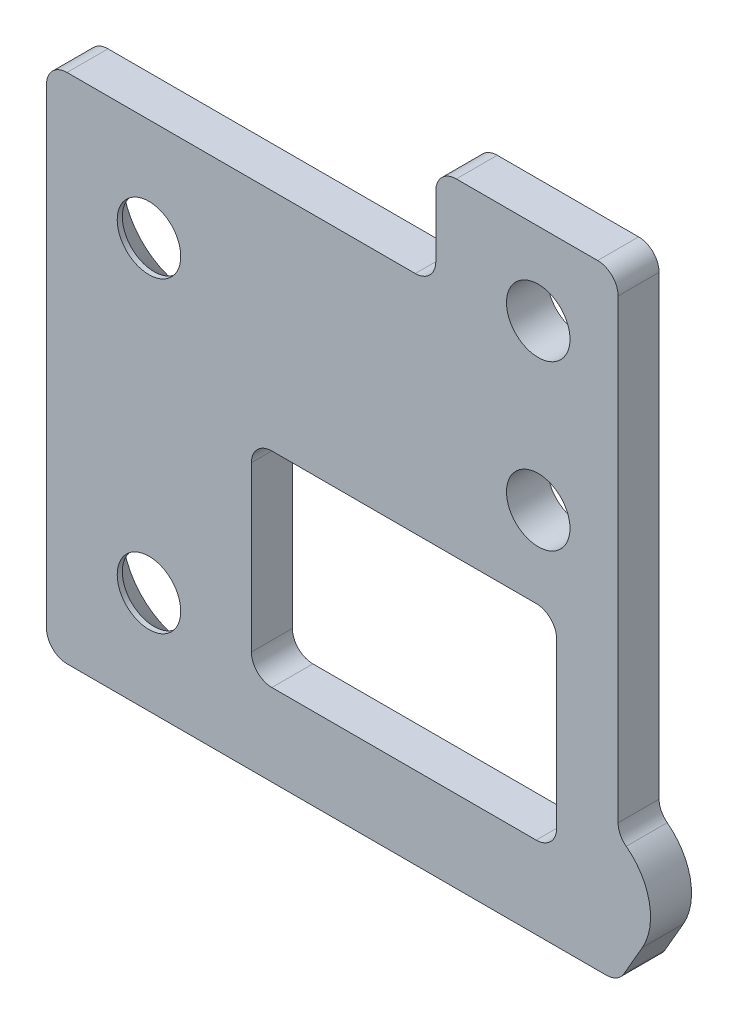
from build123d import *

# Parameters (mm, degrees)
SKETCH_1_R               = 1.55
SKETCH_1_W               = 14.9
SKETCH_1_H               = 10
EXTRUDE_1_DEPTH          = 2
FILLET_1_R               = 1
HOLE_WIZARD_1_AT_2_COUNT = 2
HOLE_WIZARD_1_AT_2_PITCH = 15
FILLET_2_R               = 3


with BuildPart() as part:
    # 草图1 → 凸台-拉伸1 (new body)
    with BuildSketch(Plane.XY):
        Polygon((9.5, -12.5), (-9.5, -12.5), (-9.5, 12.5), (9.5, 12.5), (9.5, 17.5), (18.4, 17.5), (18.4, 2.5), (18.4, -7.5), (22.730127019, -5), (18.4, -12.5), align=None)
        with Locations((14.5, 13.5)):
            Circle(SKETCH_1_R, mode=Mode.SUBTRACT)
        with Locations((14.5, 5.5)):
            Circle(SKETCH_1_R, mode=Mode.SUBTRACT)
        with Locations((-4.5, 7.5)):
            Circle(SKETCH_1_R, mode=Mode.SUBTRACT)
        with Locations(Location((-4.5, -7.5, 0), (0, 0, 180))):
            Circle(SKETCH_1_R, mode=Mode.SUBTRACT)
        with Locations((7.95, -3.5)):
            Rectangle(SKETCH_1_W, SKETCH_1_H, mode=Mode.SUBTRACT)
    extrude(amount=EXTRUDE_1_DEPTH)

    # 圆角1
    fillet_1_edges = [part.edges().sort_by_distance(p)[0] for p in [
        (-9.5, 12.5, 1),
        (9.5, 12.5, 1),
        (9.5, 17.5, 1),
        (18.4, 17.5, 1),
        (18.4, -7.5, 1),
        (18.4, -12.5, 1),
        (-9.5, -12.5, 1),
        (0.5, 1.5, 1),
        (0.5, -8.5, 1),
        (15.4, -8.5, 1),
        (15.4, 1.5, 1),
    ]]
    fillet(fillet_1_edges, radius=FILLET_1_R)

    # 草图2 → 打孔尺寸(%根据十字)槽沉头木螺钉的类型1 (revolve, cut)
    with BuildSketch(Plane(origin=(-4.5, 7.5, 0), x_dir=(0, 1, 0), z_dir=(1, 0, 0))):
        Polygon((0, 0), (0, 2), (1.55, 2), (1.55, 1.75), (3.3, 0), align=None)
    hole_wizard_1 = revolve(axis=Axis((-4.5, 7.5, -6.35), (0, 0, 1)), mode=Mode.SUBTRACT)

    # 打孔尺寸(%根据十字)槽沉头木螺钉的类型1 at 2: 打孔尺寸(%根据十字)槽沉头木螺钉的类型1 ×2
    with Locations(*[(0, -i * HOLE_WIZARD_1_AT_2_PITCH, 0) for i in range(1, HOLE_WIZARD_1_AT_2_COUNT)]):
        add(hole_wizard_1, mode=Mode.SUBTRACT)

    # 圆角2
    fillet_2_edges = [part.edges().sort_by_distance(p)[0] for p in [
        (22.730127019, -5, 1),
    ]]
    fillet(fillet_2_edges, radius=FILLET_2_R)


solid = part.part
